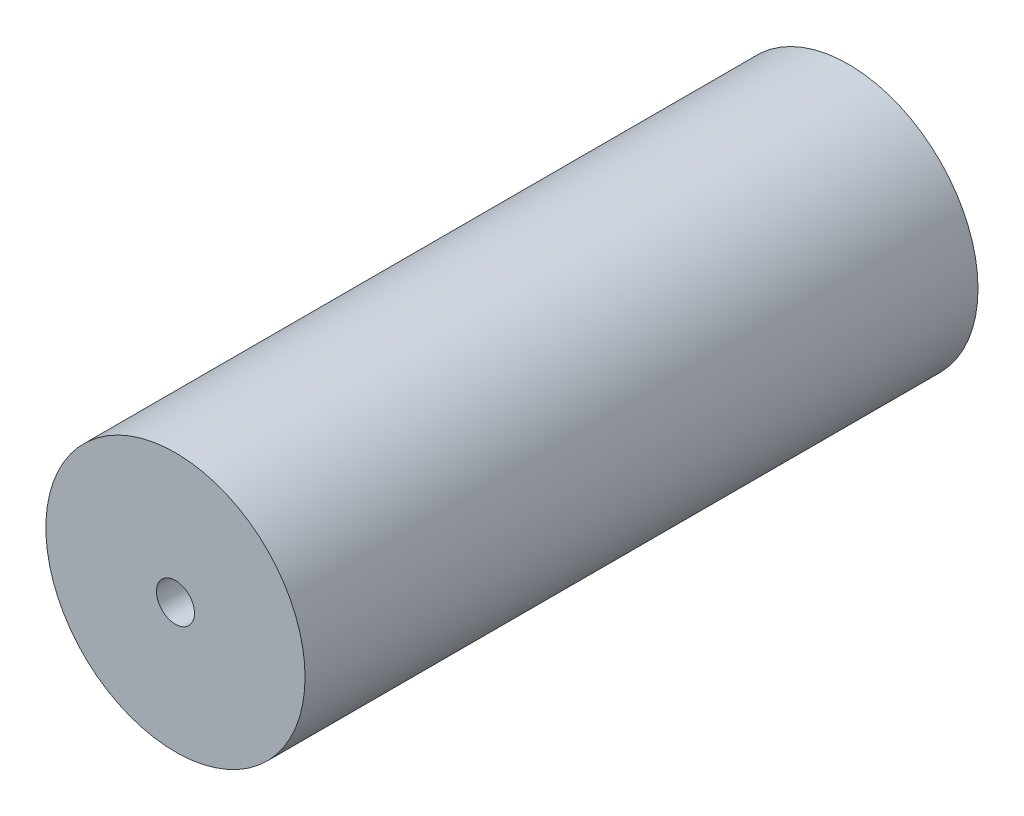
from build123d import *

# Parameters (mm, degrees)
SKETCH2_R           = 26
BOSS_EXTRUDE1_DEPTH = 135
SKETCH3_R           = 3.815
CUT_EXTRUDE1_DEPTH  = 135
SKETCH5_R           = 18.5
CUT_EXTRUDE2_DEPTH  = 30


with BuildPart() as part:
    # Sketch2 → Boss-Extrude1 (new body)
    with BuildSketch(Plane.XY):
        Circle(SKETCH2_R)
    extrude(amount=BOSS_EXTRUDE1_DEPTH)

    # Sketch3 → Cut-Extrude1 (cut)
    with BuildSketch(Plane(origin=(0, 0, 0), x_dir=(-1, 0, 0), z_dir=(0, 0, -1))):
        Circle(SKETCH3_R)
    extrude(amount=-CUT_EXTRUDE1_DEPTH, mode=Mode.SUBTRACT)

    # Sketch5 → Cut-Extrude2 (cut)
    with BuildSketch(Plane(origin=(0, 0, 0), x_dir=(-1, 0, 0), z_dir=(0, 0, -1))):
        Circle(SKETCH5_R)
    extrude(amount=-CUT_EXTRUDE2_DEPTH, mode=Mode.SUBTRACT)


solid = part.part
